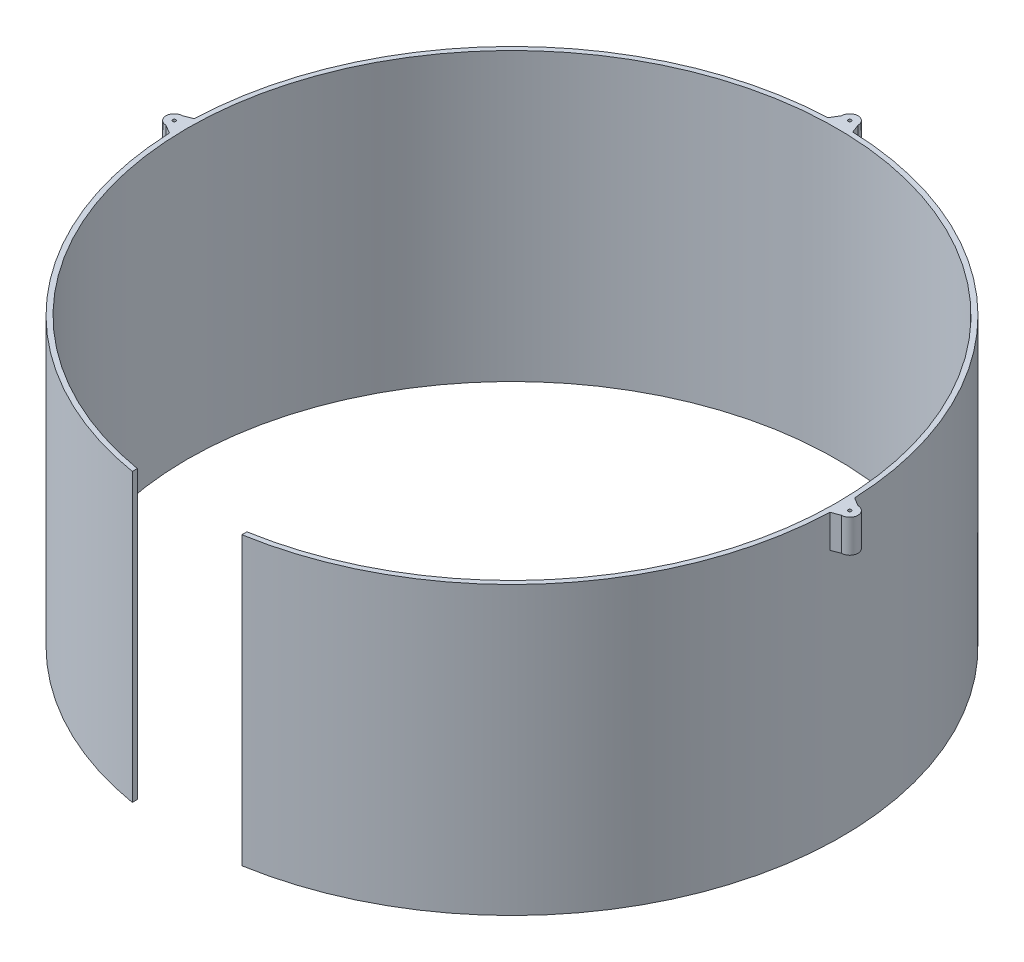
from build123d import *

# Parameters (mm, degrees)
BOSS_EXTRUDE1_DEPTH = 87
SKETCH3_R           = 0.5
BOSS_EXTRUDE2_DEPTH = 10


with BuildPart() as part:
    # Sketch1 → Boss-Extrude1 (new body)
    with BuildSketch(Plane(origin=(0, 0, 0), x_dir=(1, 0, 0), z_dir=(0, 1, 0))):
        with BuildLine():
            Line((-16.634262286, -97.085278586), (-16.634262286, -98.606801582))
            ThreePointArc((-16.634262286, -98.606801582), (0, 100), (16.634262286, -98.606801582))
            Line((16.634262286, -98.606801582), (16.634262286, -97.085278586))
            ThreePointArc((16.634262286, -97.085278586), (0, 98.5), (-16.634262286, -97.085278586))
        make_face()
    extrude(amount=BOSS_EXTRUDE1_DEPTH)

    # Sketch3 → Boss-Extrude2 (add)
    # profile 1 of 3: a face of its own
    with BuildSketch(Plane(origin=(0, 87, 0), x_dir=(1, 0, 0), z_dir=(0, 1, 0))):
        with BuildLine():
            Line((-102.5, -2.5), (-99.33644021, -4.400913329))
            Line((-99.33644021, -4.400913329), (-99.185511668, 3.770789156))
            Line((-99.185511668, 3.770789156), (-102.5, 2.5))
            ThreePointArc((-102.5, 2.5), (-105, 0), (-102.5, -2.5))
        make_face()
        with Locations(Location((-102.5, 0, 0), (0, 0, 270))):
            Circle(SKETCH3_R, mode=Mode.SUBTRACT)
    # profile 2 of 3: a face of its own
    with BuildSketch(Plane(origin=(0, 87, 0), x_dir=(1, 0, 0), z_dir=(0, 1, 0))):
        with BuildLine():
            Line((-2.5, 102.5), (-4.400913329, 99.33644021))
            Line((-4.400913329, 99.33644021), (3.770789156, 99.185511668))
            Line((3.770789156, 99.185511668), (2.5, 102.5))
            ThreePointArc((2.5, 102.5), (0, 105), (-2.5, 102.5))
        make_face()
        with Locations(Location((0, 102.5, 0), (0, 0, 270))):
            Circle(SKETCH3_R, mode=Mode.SUBTRACT)
    # profile 3 of 3: a face of its own
    with BuildSketch(Plane(origin=(0, 87, 0), x_dir=(1, 0, 0), z_dir=(0, 1, 0))):
        with BuildLine():
            Line((102.5, 2.5), (99.33644021, 4.400913329))
            Line((99.33644021, 4.400913329), (99.185511668, -3.770789156))
            Line((99.185511668, -3.770789156), (102.5, -2.5))
            ThreePointArc((102.5, -2.5), (105, 0), (102.5, 2.5))
        make_face()
        with Locations(Location((102.5, 0, 0), (0, 0, 270))):
            Circle(SKETCH3_R, mode=Mode.SUBTRACT)
    extrude(amount=-BOSS_EXTRUDE2_DEPTH)


solid = part.part
